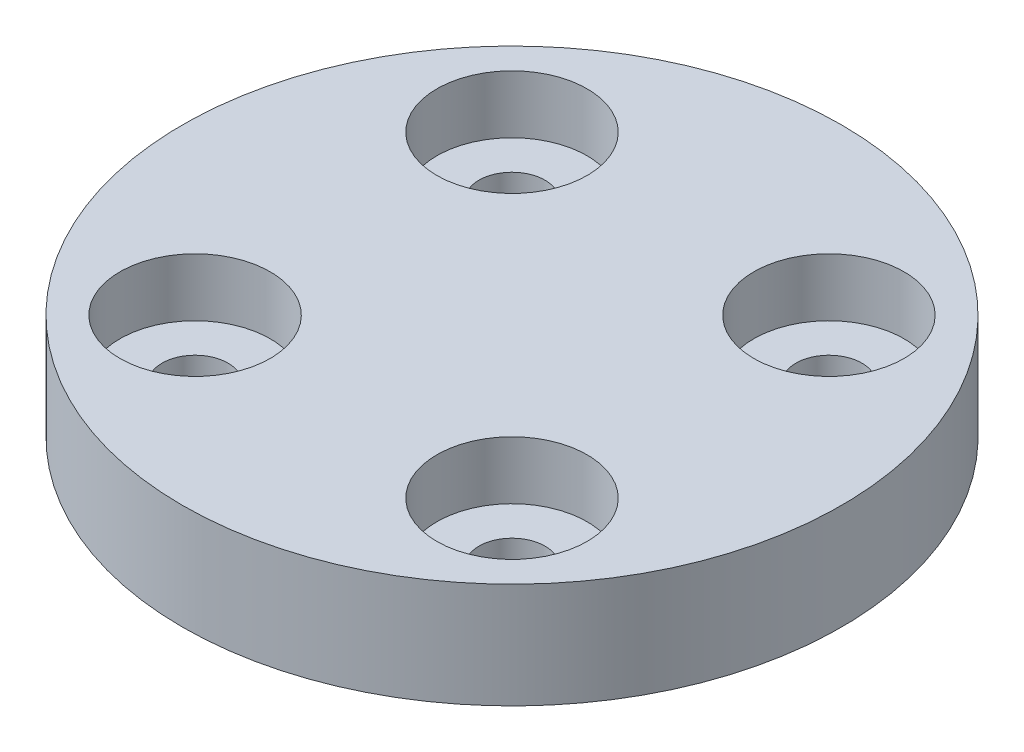
from build123d import *

# Parameters (mm, degrees)
SKETCH_1_R          = 12.5
EXTRUDE_1_DEPTH     = 4
SKETCH_2_R          = 2.85
CUT_EXTRUDE_1_DEPTH = 2.2
SKETCH_3_R          = 1.25
CUT_EXTRUDE_2_DEPTH = 10


with BuildPart() as part:
    # 草图1 → 凸台-拉伸1 (new body)
    with BuildSketch(Plane(origin=(0, 0, 0), x_dir=(1, 0, 0), z_dir=(0, 1, 0))):
        with Locations(Location((0, 0, 0), (0, 0, 270))):
            Circle(SKETCH_1_R)
    extrude(amount=EXTRUDE_1_DEPTH)

    # 草图2 → 切除-拉伸1 (cut)
    with BuildSketch(Plane(origin=(0, 4, 0), x_dir=(1, 0, 0), z_dir=(0, 1, 0))):
        with Locations(Location((6.01040764, 6.01040764, 0), (0, 0, 270))):
            Circle(SKETCH_2_R)
        with Locations(Location((6.01040764, -6.01040764, 0), (0, 0, 270))):
            Circle(SKETCH_2_R)
        with Locations(Location((-6.01040764, -6.01040764, 0), (0, 0, 270))):
            Circle(SKETCH_2_R)
        with Locations(Location((-6.01040764, 6.01040764, 0), (0, 0, 270))):
            Circle(SKETCH_2_R)
    extrude(amount=-CUT_EXTRUDE_1_DEPTH, mode=Mode.SUBTRACT)

    # 草图3 → 切除-拉伸2 (cut)
    with BuildSketch(Plane(origin=(0, 1.8, 0), x_dir=(1, 0, 0), z_dir=(0, 1, 0))):
        with Locations(Location((-6.01040764, 6.01040764, 0), (0, 0, 270))):
            Circle(SKETCH_3_R)
        with Locations(Location((6.01040764, 6.01040764, 0), (0, 0, 270))):
            Circle(SKETCH_3_R)
        with Locations(Location((6.01040764, -6.01040764, 0), (0, 0, 270))):
            Circle(SKETCH_3_R)
        with Locations(Location((-6.01040764, -6.01040764, 0), (0, 0, 270))):
            Circle(SKETCH_3_R)
    extrude(amount=-CUT_EXTRUDE_2_DEPTH, mode=Mode.SUBTRACT)


solid = part.part
